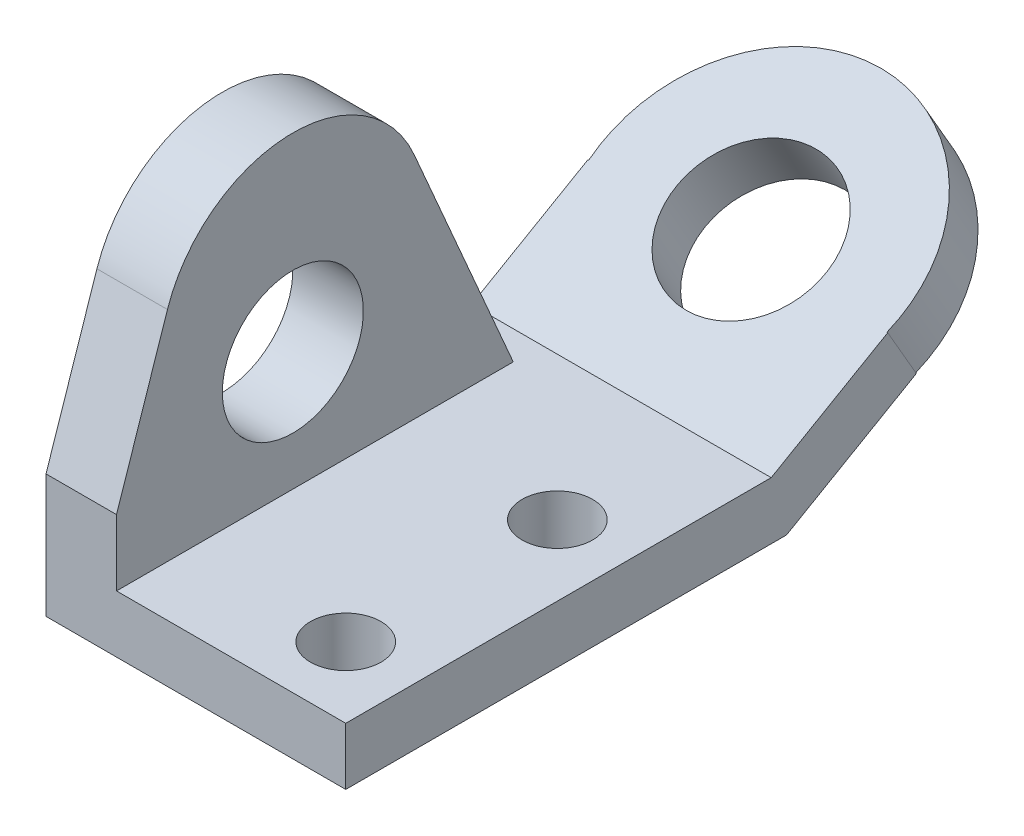
from build123d import *

# Parameters (mm, degrees)
EXTRUDE_1_DEPTH     = 34
CUT_EXTRUDE_1_REACH = 72.355
SKETCH_2_R          = 4
EXTRUDE_2_DEPTH     = 8
CUT_EXTRUDE_2_REACH = 78.907
SKETCH_4_R          = 8
CUT_EXTRUDE_3_REACH = 80.3
SKETCH_6_R          = 8.5
CUT_EXTRUDE_4_REACH = 78.907
SKETCH_9_R          = 17
EXTRUDE_5_DEPTH     = 6.5
CUT_EXTRUDE_6_REACH = 81.317
SKETCH_13_R         = 8.5


with BuildPart() as part:
    # 草图1 → 凸台-拉伸1 (new body)
    with BuildSketch(Plane(origin=(0, 0, 0), x_dir=(0, 0, -1), z_dir=(1, 0, 0))):
        Polygon((0, 0), (28.258330249, 0), (56.194863729, 16.129165125), (59.444863729, 10.5), (30, -6.5), (-20, -6.5), (-20, 0), align=None)
    extrude(amount=-EXTRUDE_1_DEPTH)

    # 草图2 → 切除-拉伸1 (cut, up to next)
    with BuildSketch(Plane(origin=(0, 0, 0), x_dir=(1, 0, 0), z_dir=(0, 1, 0)), mode=Mode.PRIVATE) as cut_extrude_1_sk1:
        with Locations(Location((-8, -12, 0), (0, 0, 270))):
            Circle(SKETCH_2_R)
    cut_extrude_1_tool1 = extrude(cut_extrude_1_sk1.sketch, amount=-CUT_EXTRUDE_1_REACH, mode=Mode.PRIVATE) & part.part
    # 草图2 → 切除-拉伸1 (cut, up to next)
    with BuildSketch(Plane(origin=(0, 0, 0), x_dir=(1, 0, 0), z_dir=(0, 1, 0)), mode=Mode.PRIVATE) as cut_extrude_1_sk2:
        with Locations(Location((-8, 12, 0), (0, 0, 270))):
            Circle(SKETCH_2_R)
    cut_extrude_1_tool2 = extrude(cut_extrude_1_sk2.sketch, amount=-CUT_EXTRUDE_1_REACH, mode=Mode.PRIVATE) & part.part
    add(cut_extrude_1_tool1.solids().sort_by_distance((-8, 0, 12))[0], mode=Mode.SUBTRACT)
    add(cut_extrude_1_tool2.solids().sort_by_distance((-8, 0, -12))[0], mode=Mode.SUBTRACT)

    # 草图3 → 凸台-拉伸2 (add)
    with BuildSketch(Plane.ZY.offset(34)):
        with BuildLine():
            Line((-25, 0), (-13.76612817, 25.957660212))
            ThreePointArc((-13.76612817, 25.957660212), (0.641385669, 34.986281207), (14.224811704, 24.759698727))
            Line((14.224811704, 24.759698727), (20, 7.5))
            Line((20, 7.5), (20, 0))
            Line((20, 0), (-25, 0))
        make_face()
    extrude(amount=-EXTRUDE_2_DEPTH)

    # 草图4 → 切除-拉伸2 (cut, up to next)
    with BuildSketch(Plane.ZY.offset(34), mode=Mode.PRIVATE) as cut_extrude_2_sk1:
        with Locations((0, 13.5)):
            Circle(SKETCH_4_R)
    cut_extrude_2_tool1 = extrude(cut_extrude_2_sk1.sketch, amount=-CUT_EXTRUDE_2_REACH, mode=Mode.PRIVATE) & part.part
    add(cut_extrude_2_tool1.solids().sort_by_distance((-34, 13.5, 0))[0], mode=Mode.SUBTRACT)

    # 草图6 → 切除-拉伸3 (cut, up to next)
    with BuildSketch(Plane(origin=(0, -12.236215932, -7.064582562), x_dir=(1, 0, 0), z_dir=(0, 0.8660254037844378, 0.5000000000000017)), mode=Mode.PRIVATE) as cut_extrude_3_sk1:
        with Locations(Location((-17, 41.472431864, 0), (0, 0, 270))):
            Circle(SKETCH_6_R)
    cut_extrude_3_tool1 = extrude(cut_extrude_3_sk1.sketch, amount=-CUT_EXTRUDE_3_REACH, mode=Mode.PRIVATE) & part.part
    add(cut_extrude_3_tool1.solids().sort_by_distance((-17, 8.5, -42.980762))[0], mode=Mode.SUBTRACT)

    # 草图8 → 切除-拉伸4 (cut, up to next)
    with BuildSketch(Plane(origin=(0, 0, 0), x_dir=(0, 0, -1), z_dir=(1, 0, 0)), mode=Mode.PRIVATE) as cut_extrude_4_sk1:
        Polygon((44.722431864, 2), (41.472431864, 7.629165125), (56.194863729, 16.129165125), (59.444863729, 10.5), align=None)
    cut_extrude_4_tool1 = extrude(cut_extrude_4_sk1.sketch, amount=-CUT_EXTRUDE_4_REACH, mode=Mode.PRIVATE) & part.part
    add(cut_extrude_4_tool1.solids().sort_by_distance((0, 9.064583, -50.458648))[0], mode=Mode.SUBTRACT)

    # 草图9 → 凸台-拉伸5 (add)
    with BuildSketch(Plane(origin=(0, -12.236215932, -7.064582562), x_dir=(1, 0, 0), z_dir=(0, 0.8660254037844378, 0.5000000000000017))):
        with Locations((-17, 41.472431864)):
            Circle(SKETCH_9_R)
    extrude(amount=-EXTRUDE_5_DEPTH)

    # 草图13 → 切除-拉伸6 (cut, up to next)
    with BuildSketch(Plane(origin=(0, -12.236215932, -7.064582562), x_dir=(1, 0, 0), z_dir=(0, 0.8660254037844378, 0.5000000000000017)), mode=Mode.PRIVATE) as cut_extrude_6_sk1:
        with Locations(Location((-17, 41.472431864, 0), (0, 0, 270))):
            Circle(SKETCH_13_R)
    cut_extrude_6_tool1 = extrude(cut_extrude_6_sk1.sketch, amount=-CUT_EXTRUDE_6_REACH, mode=Mode.PRIVATE) & part.part
    add(cut_extrude_6_tool1.solids().sort_by_distance((-17, 8.5, -42.980762))[0], mode=Mode.SUBTRACT)


solid = part.part
